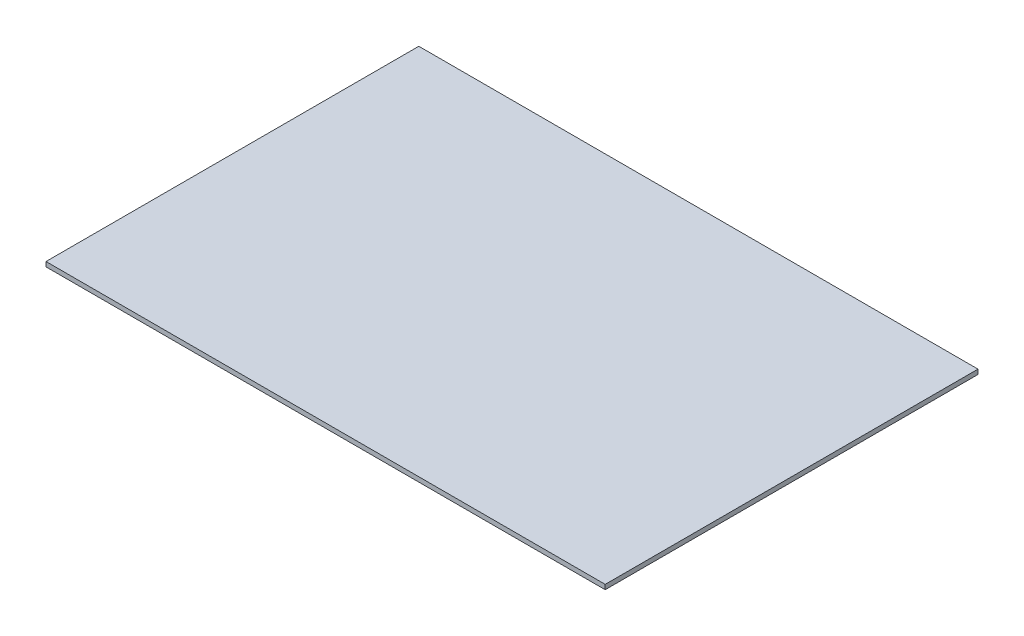
from build123d import *

# Parameters (mm, degrees)
SKETCH1_W           = 304.8
SKETCH1_H           = 203.2
BOSS_EXTRUDE1_DEPTH = 2.54


with BuildPart() as part:
    # Sketch1 → Boss-Extrude1 (new body)
    with BuildSketch(Plane(origin=(0, 0, 0), x_dir=(1, 0, 0), z_dir=(0, 1, 0))):
        with Locations((152.4, 101.6)):
            Rectangle(SKETCH1_W, SKETCH1_H)
    extrude(amount=BOSS_EXTRUDE1_DEPTH)


solid = part.part
